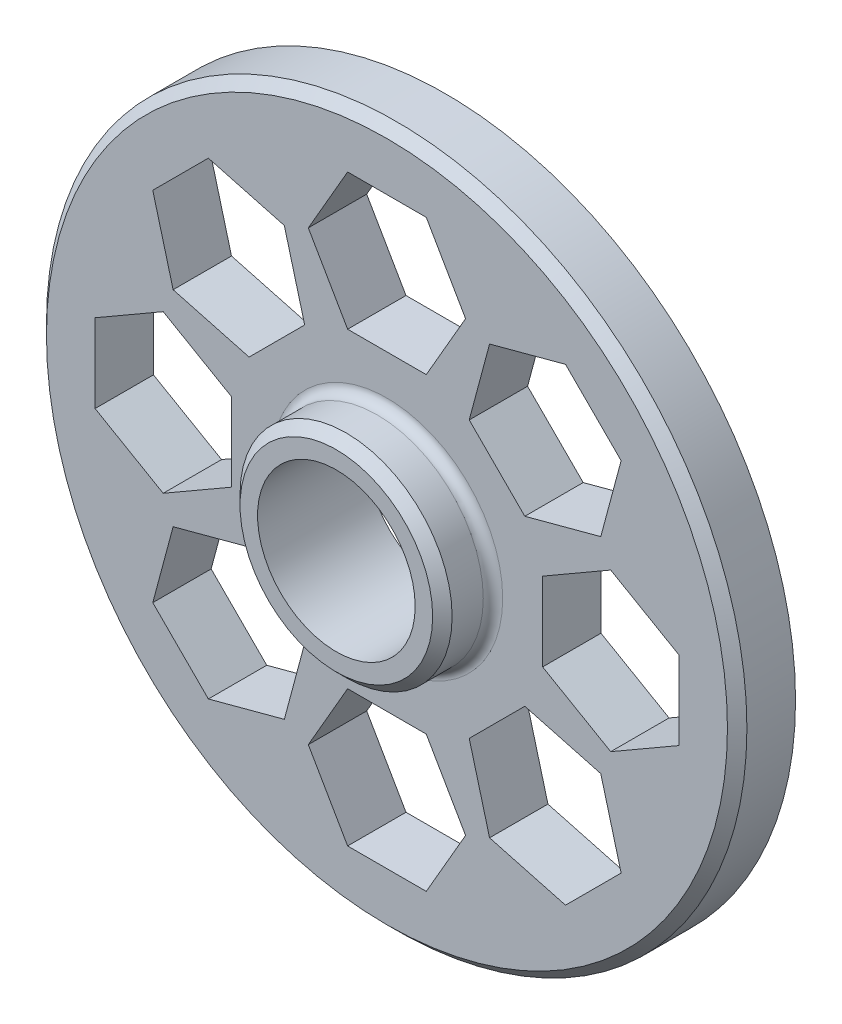
from build123d import *

# Parameters (mm, degrees)
CROQUIS1_R              = 18
SALIENTE_EXTRUIR1_DEPTH = 3
CROQUIS2_R              = 5.45
SALIENTE_EXTRUIR2_DEPTH = 2.6
CHAFL_N1_SIZE           = 0.5
REDONDEO1_R             = 0.5
CORTAR_EXTRUIR1_DEPTH   = 3
MATRIZC1_COUNT          = 8
CROQUIS4_R              = 4.05
CORTAR_EXTRUIR2_DEPTH   = 27.064535292


with BuildPart() as part:
    # Croquis1 → Saliente-Extruir1 (new body)
    with BuildSketch(Plane(origin=(0, 0, 0), x_dir=(0, 1, 0), z_dir=(0, 0, 1))):
        with Locations(Location((0, 0, 0), (0, 0, 270))):
            Circle(CROQUIS1_R)
    extrude(amount=SALIENTE_EXTRUIR1_DEPTH)

    # Croquis2 → Saliente-Extruir2 (add)
    with BuildSketch(Plane.XY.offset(3)):
        Circle(CROQUIS2_R)
    extrude(amount=SALIENTE_EXTRUIR2_DEPTH)

    # Chaflán1
    chafl_n1_edges = [part.edges().sort_by_distance(p)[0] for p in [
        (-18, 0, 3),
        (-5.45, 0, 5.6),
    ]]
    chamfer(chafl_n1_edges, length=CHAFL_N1_SIZE)

    # Redondeo1
    redondeo1_edges = [part.edges().sort_by_distance(p)[0] for p in [
        (-5.45, 0, 3),
    ]]
    fillet(redondeo1_edges, radius=REDONDEO1_R)

    # Croquis3 → Cortar-Extruir1 (cut)
    with BuildSketch(Plane.XY.offset(3)):
        Polygon((-4.041451884, 11.5), (-2.020725942, 8), (2.020725942, 8), (4.041451884, 11.5), (2.020725942, 15), (-2.020725942, 15), align=None)
    cortar_extruir1 = extrude(amount=-CORTAR_EXTRUIR1_DEPTH, mode=Mode.SUBTRACT)

    # MatrizC1: Cortar-Extruir1 ×8 about axis
    matrizc1_axis = Axis((0, 0, 0), (0, 0, 1))
    for i in range(1, MATRIZC1_COUNT):
        add(cortar_extruir1.rotate(matrizc1_axis, i * 360 / MATRIZC1_COUNT), mode=Mode.SUBTRACT)

    # Croquis4 → Cortar-Extruir2 (cut, through all)
    with BuildSketch(Plane.XY.offset(5.6)):
        Circle(CROQUIS4_R)
    extrude(amount=-CORTAR_EXTRUIR2_DEPTH, mode=Mode.SUBTRACT)


solid = part.part
